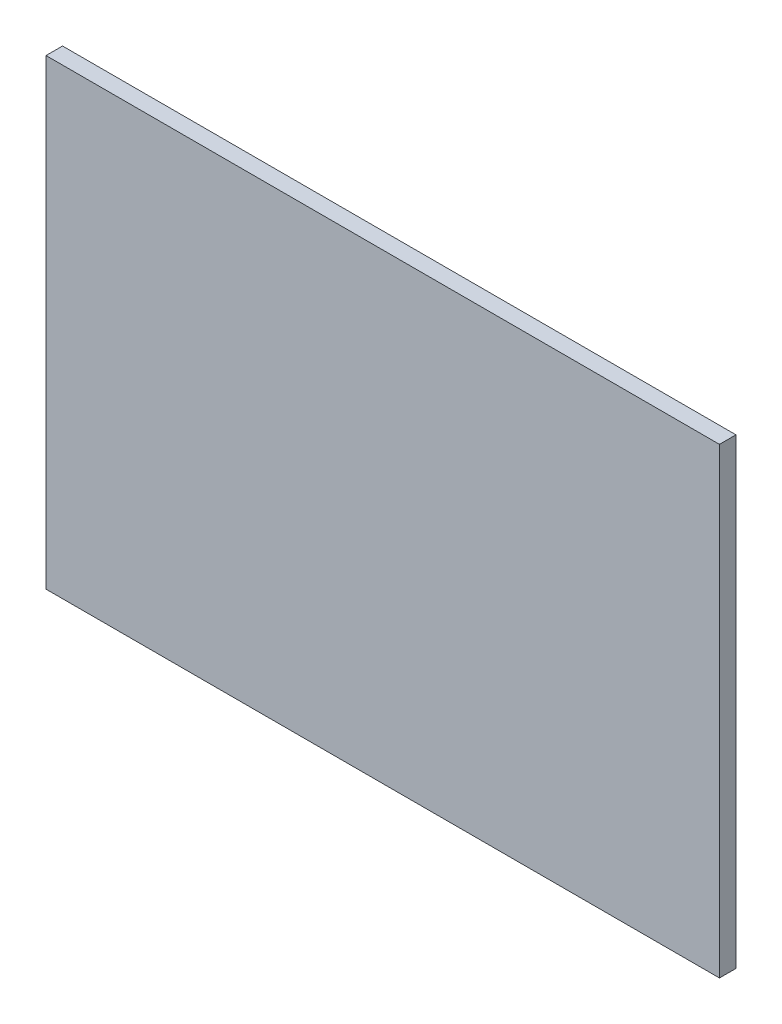
from build123d import *

# Parameters (mm, degrees)
SKETCH_1_W      = 61.2
SKETCH_1_H      = 42
EXTRUDE_1_DEPTH = 1.5


with BuildPart() as part:
    # Эскиз1 → Бобышка-Вытянуть1 (new body)
    with BuildSketch(Plane.XY):
        Rectangle(SKETCH_1_W, SKETCH_1_H)
    extrude(amount=EXTRUDE_1_DEPTH)


solid = part.part
